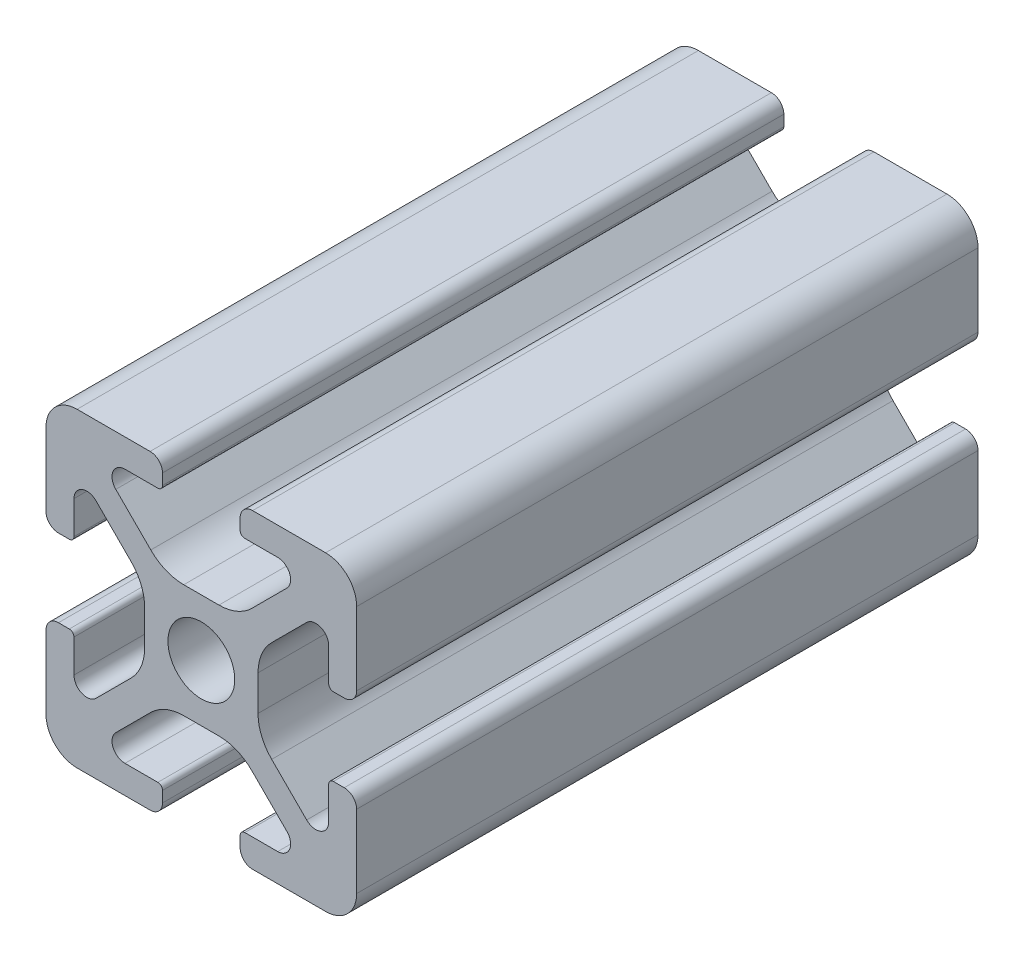
from build123d import *

# Parameters (mm, degrees)
ESQUISSE1_R      = 2.15
EXTRUSION1_DEPTH = 40


with BuildPart() as part:
    # Esquisse1 → Extrusion1 (new body)
    with BuildSketch(Plane(origin=(0, 0, 0), x_dir=(-1, 0, 0), z_dir=(0, 0, -1))):
        with BuildLine():
            Line((-18, 0), (-13.3, 0))
            ThreePointArc((-13.3, 0), (-12.734314575, 0.234314575), (-12.5, 0.8))
            Line((-12.5, 0.8), (-12.5, 1.5))
            ThreePointArc((-12.5, 1.5), (-12.587867966, 1.712132034), (-12.8, 1.8))
            Line((-12.8, 1.8), (-14.918424061, 1.8))
            ThreePointArc((-14.918424061, 1.8), (-15.686700051, 2.313345604), (-15.506437047, 3.219588924))
            Line((-15.506437047, 3.219588924), (-13.254705627, 5.471320344))
            ThreePointArc((-13.254705627, 5.471320344), (-12.281435581, 6.121638598), (-11.133385284, 6.35))
            Line((-11.133385284, 6.35), (-8.866614716, 6.35))
            ThreePointArc((-8.866614716, 6.35), (-7.718564419, 6.121638598), (-6.745294373, 5.471320344))
            Line((-6.745294373, 5.471320344), (-4.493562953, 3.219588924))
            ThreePointArc((-4.493562953, 3.219588924), (-4.313299949, 2.313345604), (-5.081575939, 1.8))
            Line((-5.081575939, 1.8), (-7.2, 1.8))
            ThreePointArc((-7.2, 1.8), (-7.412132034, 1.712132034), (-7.5, 1.5))
            Line((-7.5, 1.5), (-7.5, 0.8))
            ThreePointArc((-7.5, 0.8), (-7.265685425, 0.234314575), (-6.7, 0))
            Line((-6.7, 0), (-2, 0))
            ThreePointArc((-2, 0), (-0.585786438, 0.585786438), (0, 2))
            Line((0, 2), (0, 6.7))
            ThreePointArc((0, 6.7), (-0.234314575, 7.265685425), (-0.8, 7.5))
            Line((-0.8, 7.5), (-1.5, 7.5))
            ThreePointArc((-1.5, 7.5), (-1.712132034, 7.412132034), (-1.8, 7.2))
            Line((-1.8, 7.2), (-1.8, 5.081575939))
            ThreePointArc((-1.8, 5.081575939), (-2.313345604, 4.313299949), (-3.219588924, 4.493562953))
            Line((-3.219588924, 4.493562953), (-5.471320344, 6.745294373))
            ThreePointArc((-5.471320344, 6.745294373), (-6.121638598, 7.718564419), (-6.35, 8.866614716))
            Line((-6.35, 8.866614716), (-6.35, 11.133385284))
            ThreePointArc((-6.35, 11.133385284), (-6.121638598, 12.281435581), (-5.471320344, 13.254705627))
            Line((-5.471320344, 13.254705627), (-3.219588924, 15.506437047))
            ThreePointArc((-3.219588924, 15.506437047), (-2.313345604, 15.686700051), (-1.8, 14.918424061))
            Line((-1.8, 14.918424061), (-1.8, 12.8))
            ThreePointArc((-1.8, 12.8), (-1.712132034, 12.587867966), (-1.5, 12.5))
            Line((-1.5, 12.5), (-0.8, 12.5))
            ThreePointArc((-0.8, 12.5), (-0.234314575, 12.734314575), (0, 13.3))
            Line((0, 13.3), (0, 18))
            ThreePointArc((0, 18), (-0.585786438, 19.414213562), (-2, 20))
            Line((-2, 20), (-6.7, 20))
            ThreePointArc((-6.7, 20), (-7.265685425, 19.765685425), (-7.5, 19.2))
            Line((-7.5, 19.2), (-7.5, 18.5))
            ThreePointArc((-7.5, 18.5), (-7.412132034, 18.287867966), (-7.2, 18.2))
            Line((-7.2, 18.2), (-5.081575939, 18.2))
            ThreePointArc((-5.081575939, 18.2), (-4.313299949, 17.686654396), (-4.493562953, 16.780411076))
            Line((-4.493562953, 16.780411076), (-6.745294373, 14.528679656))
            ThreePointArc((-6.745294373, 14.528679656), (-7.718564419, 13.878361402), (-8.866614716, 13.65))
            Line((-8.866614716, 13.65), (-11.133385284, 13.65))
            ThreePointArc((-11.133385284, 13.65), (-12.281435581, 13.878361402), (-13.254705627, 14.528679656))
            Line((-13.254705627, 14.528679656), (-15.506437047, 16.780411076))
            ThreePointArc((-15.506437047, 16.780411076), (-15.686700051, 17.686654396), (-14.918424061, 18.2))
            Line((-14.918424061, 18.2), (-12.8, 18.2))
            ThreePointArc((-12.8, 18.2), (-12.587867966, 18.287867966), (-12.5, 18.5))
            Line((-12.5, 18.5), (-12.5, 19.2))
            ThreePointArc((-12.5, 19.2), (-12.734314575, 19.765685425), (-13.3, 20))
            Line((-13.3, 20), (-18, 20))
            ThreePointArc((-18, 20), (-19.414213562, 19.414213562), (-20, 18))
            Line((-20, 18), (-20, 13.3))
            ThreePointArc((-20, 13.3), (-19.765685425, 12.734314575), (-19.2, 12.5))
            Line((-19.2, 12.5), (-18.5, 12.5))
            ThreePointArc((-18.5, 12.5), (-18.287867966, 12.587867966), (-18.2, 12.8))
            Line((-18.2, 12.8), (-18.2, 14.918424061))
            ThreePointArc((-18.2, 14.918424061), (-17.686654396, 15.686700051), (-16.780411076, 15.506437047))
            Line((-16.780411076, 15.506437047), (-14.528679656, 13.254705627))
            ThreePointArc((-14.528679656, 13.254705627), (-13.878361402, 12.281435581), (-13.65, 11.133385284))
            Line((-13.65, 11.133385284), (-13.65, 8.866614716))
            ThreePointArc((-13.65, 8.866614716), (-13.878361402, 7.718564419), (-14.528679656, 6.745294373))
            Line((-14.528679656, 6.745294373), (-16.780411076, 4.493562953))
            ThreePointArc((-16.780411076, 4.493562953), (-17.686654396, 4.313299949), (-18.2, 5.081575939))
            Line((-18.2, 5.081575939), (-18.2, 7.2))
            ThreePointArc((-18.2, 7.2), (-18.287867966, 7.412132034), (-18.5, 7.5))
            Line((-18.5, 7.5), (-19.2, 7.5))
            ThreePointArc((-19.2, 7.5), (-19.765685425, 7.265685425), (-20, 6.7))
            Line((-20, 6.7), (-20, 2))
            ThreePointArc((-20, 2), (-19.414213562, 0.585786438), (-18, 0))
        make_face()
        with Locations(Location((-10, 10, 0), (0, 0, 180))):
            Circle(ESQUISSE1_R, mode=Mode.SUBTRACT)
    extrude(amount=-EXTRUSION1_DEPTH)


solid = part.part
